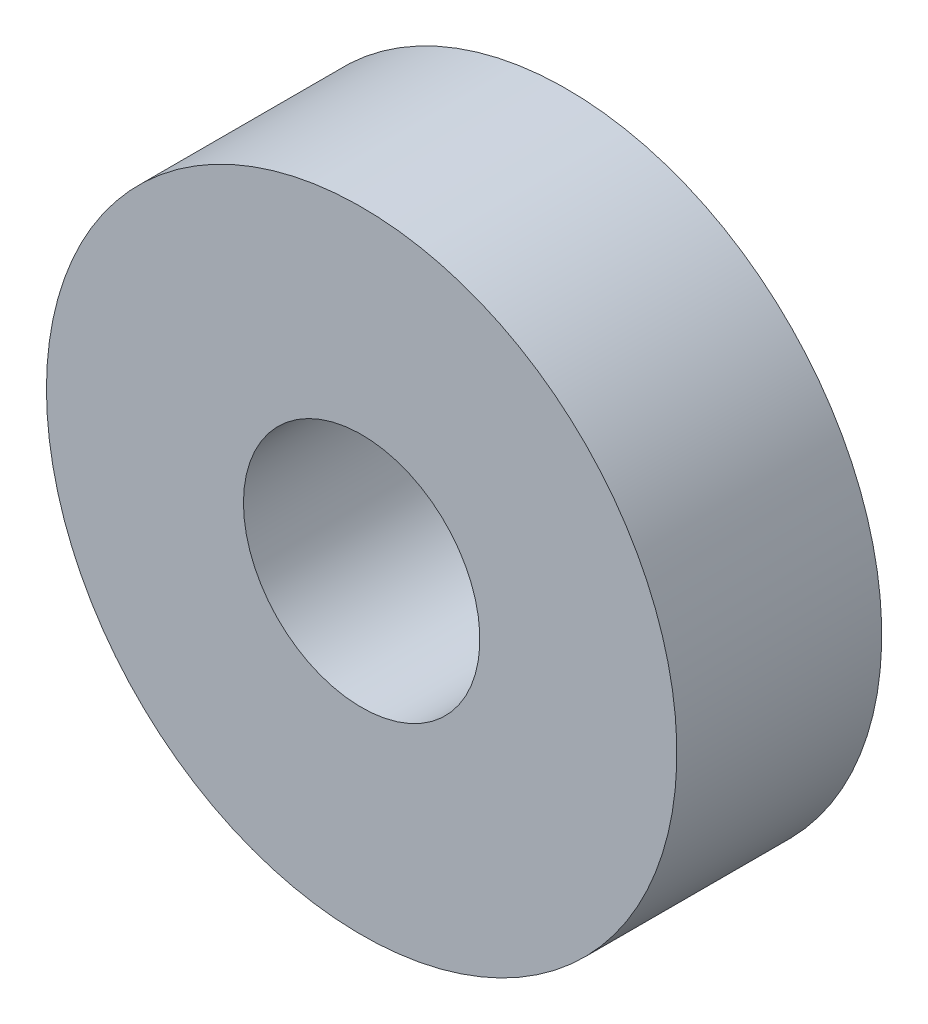
from build123d import *

# Parameters (mm, degrees)
SKETCH1_R           = 20
SKETCH1_R_2         = 7.5
BOSS_EXTRUDE1_DEPTH = 13


with BuildPart() as part:
    # Sketch1 → Boss-Extrude1 (new body)
    with BuildSketch(Plane.XY):
        with Locations(Location((0, 0, 0), (0, 0, 180))):
            Circle(SKETCH1_R)
        with Locations(Location((0, 0, 0), (0, 0, 180))):
            Circle(SKETCH1_R_2, mode=Mode.SUBTRACT)
    extrude(amount=BOSS_EXTRUDE1_DEPTH)


solid = part.part
